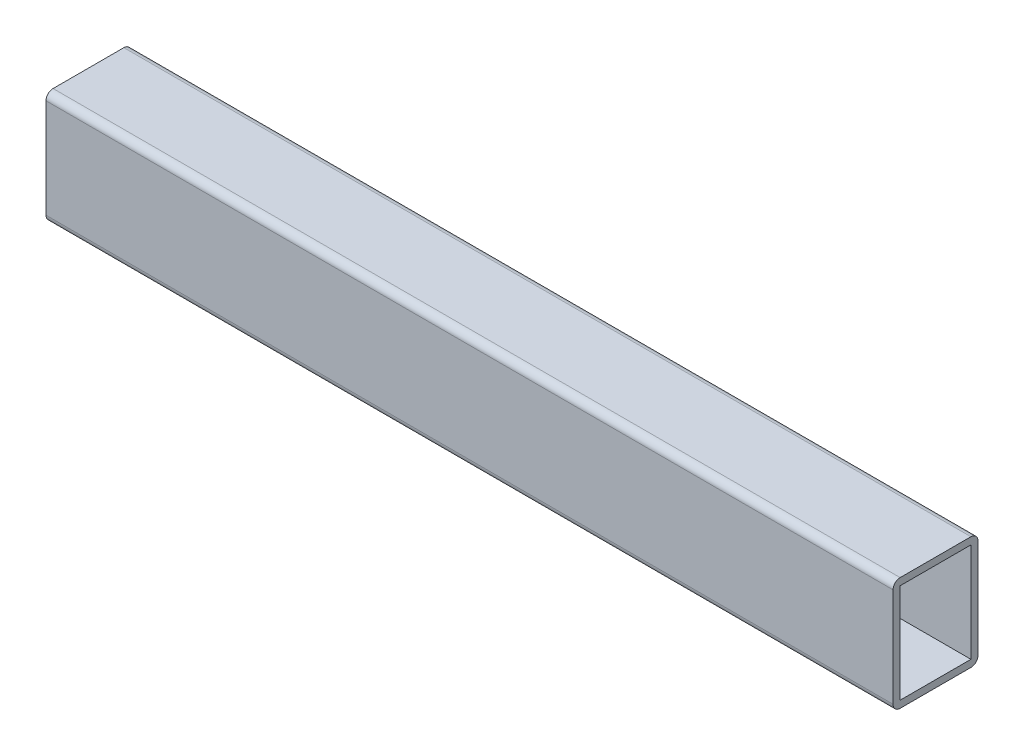
from build123d import *

# Parameters (mm, degrees)
SKETCH1_W      = 31.75
SKETCH1_H      = 44.45
EXTRUDE1_DEPTH = 380


with BuildPart() as part:
    # Sketch1 → Extrude1 (new body)
    with BuildSketch(Plane(origin=(0, 0, 0), x_dir=(0, 0, -1), z_dir=(1, 0, 0))):
        with BuildLine():
            Line((-15.875, 25.4), (15.875, 25.4))
            ThreePointArc((15.875, 25.4), (18.12006403, 24.47006403), (19.05, 22.225))
            Line((19.05, 22.225), (19.05, -22.225))
            ThreePointArc((19.05, -22.225), (18.12006403, -24.47006403), (15.875, -25.4))
            Line((15.875, -25.4), (-15.875, -25.4))
            ThreePointArc((-15.875, -25.4), (-18.12006403, -24.47006403), (-19.05, -22.225))
            Line((-19.05, -22.225), (-19.05, 22.225))
            ThreePointArc((-19.05, 22.225), (-18.12006403, 24.47006403), (-15.875, 25.4))
        make_face()
        Rectangle(SKETCH1_W, SKETCH1_H, mode=Mode.SUBTRACT)
    extrude(amount=EXTRUDE1_DEPTH)


solid = part.part
